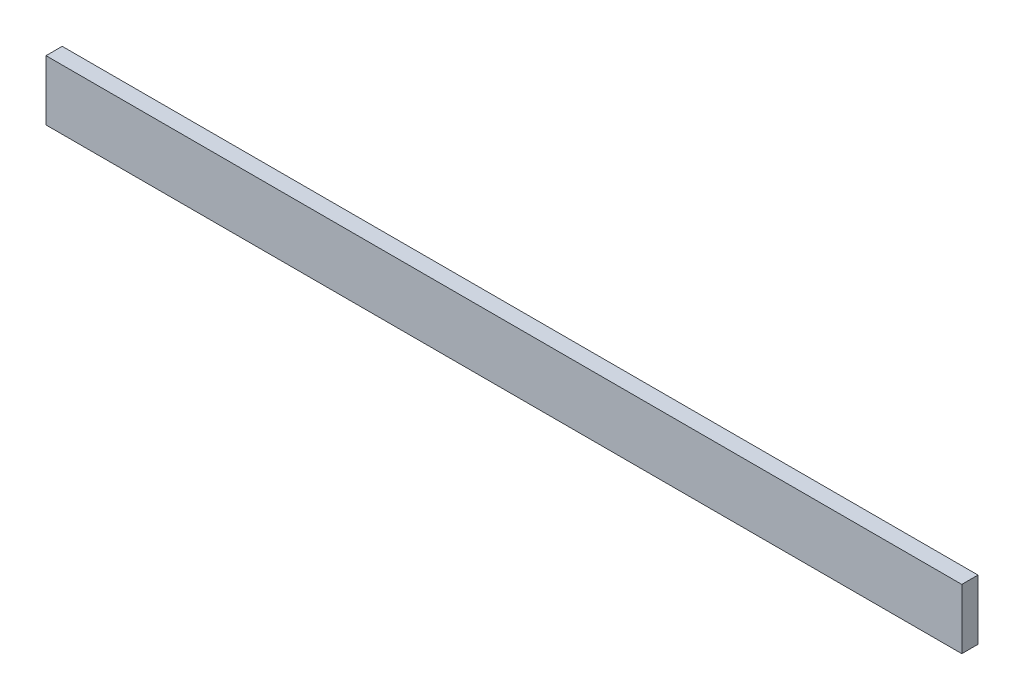
from build123d import *

# Parameters (mm, degrees)
ESQUISSE1_W        = 1526
ESQUISSE1_H        = 100
BOSS_EXTRU_1_DEPTH = 27


with BuildPart() as part:
    # Esquisse1 → Boss.-Extru.1 (new body)
    with BuildSketch(Plane.XY):
        with Locations((763, 50)):
            Rectangle(ESQUISSE1_W, ESQUISSE1_H)
    extrude(amount=BOSS_EXTRU_1_DEPTH)


solid = part.part
